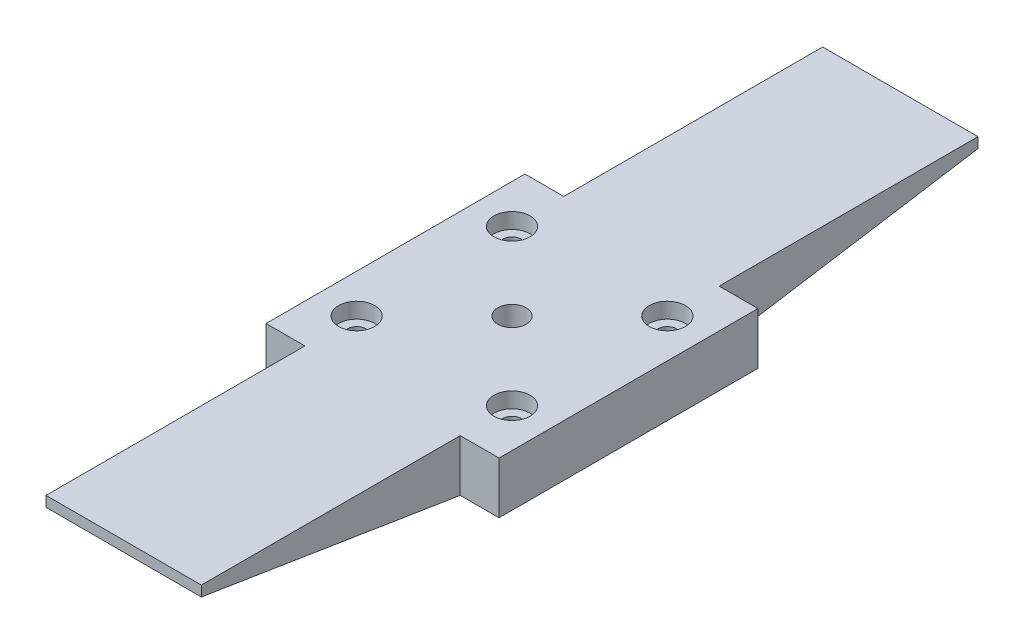
from build123d import *

# Parameters (mm, degrees)
BOSS_EXTRUDE1_DEPTH = 45
SKETCH3_R           = 3.5
CUT_EXTRUDE1_DEPTH  = 2
SKETCH4_R           = 1.75
CUT_EXTRUDE2_DEPTH  = 8
CUT_EXTRUDE3_START  = -3
SKETCH5_R           = 3.5
CUT_EXTRUDE3_DEPTH  = 3
CUT_EXTRUDE4_DEPTH  = 7.5
SKETCH8_R           = 2.75
CUT_EXTRUDE5_DEPTH  = 10


with BuildPart() as part:
    # Sketch2 → Boss-Extrude1 (new body)
    with BuildSketch(Plane(origin=(0, 0, 0), x_dir=(0, 0, -1), z_dir=(1, 0, 0))):
        Polygon((-75, 0), (75, 0), (75, -2), (25, -10), (-25, -10), (-75, -2), align=None)
    extrude(amount=BOSS_EXTRUDE1_DEPTH)

    # Sketch3 → Cut-Extrude1 (cut)
    with BuildSketch(Plane.XZ.offset(10)):
        with Locations(Location((7.5, 15, 0), (0, 0, 270))):
            Circle(SKETCH3_R)
        with Locations(Location((37.5, 15, 0), (0, 0, 270))):
            Circle(SKETCH3_R)
        with Locations(Location((37.5, -15, 0), (0, 0, 270))):
            Circle(SKETCH3_R)
        with Locations(Location((7.5, -15, 0), (0, 0, 270))):
            Circle(SKETCH3_R)
    extrude(amount=-CUT_EXTRUDE1_DEPTH, mode=Mode.SUBTRACT)

    # Sketch4 → Cut-Extrude2 (cut)
    with BuildSketch(Plane.XZ.offset(8)):
        with Locations(Location((7.5, 15, 0), (0, 0, 270))):
            Circle(SKETCH4_R)
        with Locations(Location((7.5, -15, 0), (0, 0, 270))):
            Circle(SKETCH4_R)
        with Locations(Location((37.5, -15, 0), (0, 0, 270))):
            Circle(SKETCH4_R)
        with Locations(Location((37.5, 15, 0), (0, 0, 270))):
            Circle(SKETCH4_R)
    extrude(amount=-CUT_EXTRUDE2_DEPTH, mode=Mode.SUBTRACT)

    # Sketch5 → Cut-Extrude3 (cut)
    with BuildSketch(Plane(origin=(0, 0, 0), x_dir=(1, 0, 0), z_dir=(0, 1, 0)).offset(CUT_EXTRUDE3_START)):
        with Locations(Location((7.5, 15, 0), (0, 0, 90))):
            Circle(SKETCH5_R)
        with Locations(Location((37.5, 15, 0), (0, 0, 90))):
            Circle(SKETCH5_R)
        with Locations(Location((7.5, -15, 0), (0, 0, 90))):
            Circle(SKETCH5_R)
        with Locations(Location((37.5, -15, 0), (0, 0, 90))):
            Circle(SKETCH5_R)
    extrude(amount=CUT_EXTRUDE3_DEPTH, mode=Mode.SUBTRACT)

    # Sketch6 → Cut-Extrude4 (cut)
    with BuildSketch(Plane(origin=(45, 0, 0), x_dir=(0, 0, -1), z_dir=(1, 0, 0))):
        Polygon((25, -10), (25, 0), (75, 0), (75, -2), align=None)
        Polygon((-25, -10), (-25, 0), (-75, 0), (-75, -2), align=None)
    cut_extrude4 = extrude(amount=-CUT_EXTRUDE4_DEPTH, mode=Mode.SUBTRACT)

    # Mirror1: Cut-Extrude4 across plane
    add(cut_extrude4.mirror(Plane(origin=(22.5, 0, 0), x_dir=(0, 0, 1), z_dir=(1, 0, 0))), mode=Mode.SUBTRACT)

    # Sketch8 → Cut-Extrude5 (cut)
    with BuildSketch(Plane.XZ.offset(10)):
        with Locations(Location((22.5, 0, 0), (0, 0, 270))):
            Circle(SKETCH8_R)
    extrude(amount=-CUT_EXTRUDE5_DEPTH, mode=Mode.SUBTRACT)


solid = part.part
